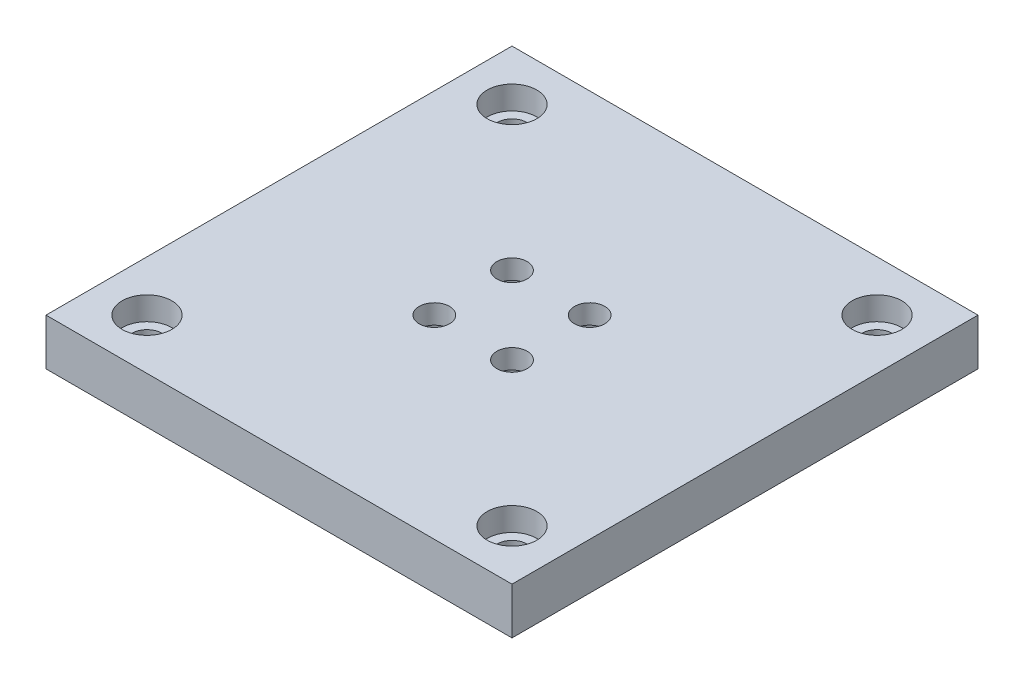
from build123d import *

# Parameters (mm, degrees)
SKIZZE1_W                       = 60
SKIZZE1_H                       = 60
AUFSATZ_LINEAR_AUSTRAGEN1_DEPTH = 6
BOHRUNG3_D                      = 3.9
BOHRUNG3_CBORE_D                = 6.4
BOHRUNG3_CBORE_DEPTH            = 3.5
BOHRUNG4_D                      = 3.9
BOHRUNG4_DEPTH                  = 100
BOHRUNG4_CBORE_D                = 6.4
BOHRUNG4_CBORE_DEPTH            = 3


with BuildPart() as part:
    # Skizze1 → Aufsatz-Linear austragen1 (new body)
    with BuildSketch(Plane(origin=(0, 0, 0), x_dir=(1, 0, 0), z_dir=(0, 1, 0))):
        with Locations((25, 30)):
            Rectangle(SKIZZE1_W, SKIZZE1_H)
    extrude(amount=AUFSATZ_LINEAR_AUSTRAGEN1_DEPTH)

    # Bohrung3 (through all)
    with Locations(Plane(origin=(20, 0, -25), x_dir=(0, 0, -1), z_dir=(0, -1, 0))):
        with Locations((0, 0), (0, 10), (10, 10), (10, 0)):
            CounterBoreHole(BOHRUNG3_D / 2, BOHRUNG3_CBORE_D / 2, BOHRUNG3_CBORE_DEPTH)

    # Bohrung4
    with Locations(Plane(origin=(1.5, 6, -53.5), x_dir=(0, 0, 1), z_dir=(0, 1, 0))):
        with Locations((0, 0), (0, 47), (47, 47), (47, 0)):
            CounterBoreHole(BOHRUNG4_D / 2, BOHRUNG4_CBORE_D / 2, BOHRUNG4_CBORE_DEPTH, depth=BOHRUNG4_DEPTH)


solid = part.part
